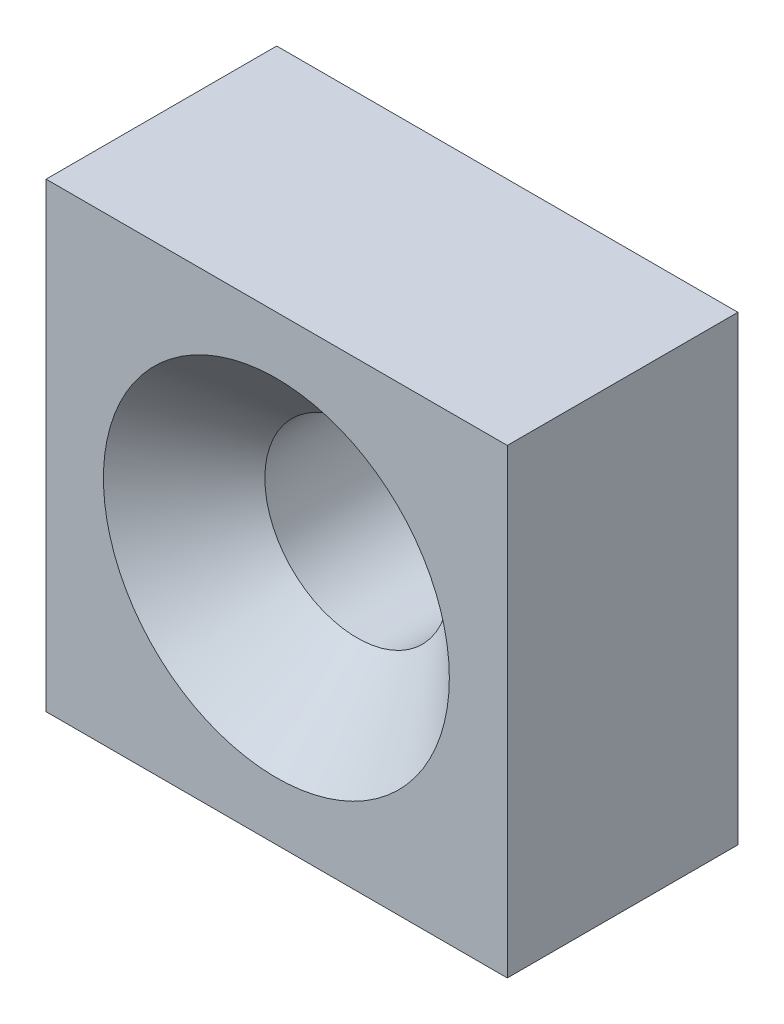
from build123d import *

# Parameters (mm, degrees)
SKETCH_1_W                          = 20
SKETCH_1_H                          = 20
BASEBOX_DEPTH                       = 10
HOLE_CS_ISO_FLATHEAD_M8_D           = 8
HOLE_CS_ISO_FLATHEAD_M8_CSINK_D     = 15
HOLE_CS_ISO_FLATHEAD_M8_CSINK_ANGLE = 90


with BuildPart() as part:
    # 草图1 → BaseBox (new body)
    with BuildSketch(Plane.XY):
        with Locations((10, 10)):
            Rectangle(SKETCH_1_W, SKETCH_1_H)
    extrude(amount=BASEBOX_DEPTH)

    # Hole_cs_iso_flathead_m8 (through all)
    with Locations(Plane.XY.offset(10)):
        with Locations((9.986487375, 10.014305599)):
            CounterSinkHole(HOLE_CS_ISO_FLATHEAD_M8_D / 2, HOLE_CS_ISO_FLATHEAD_M8_CSINK_D / 2, counter_sink_angle=HOLE_CS_ISO_FLATHEAD_M8_CSINK_ANGLE)


solid = part.part
